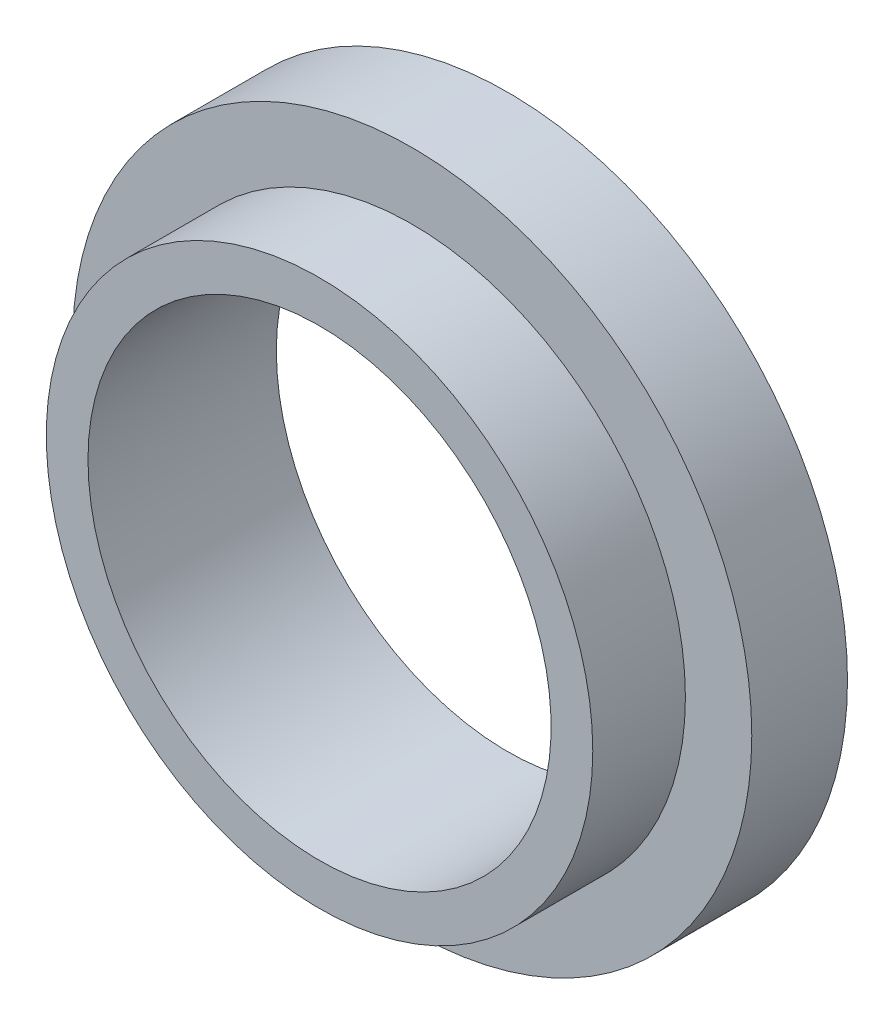
from build123d import *

# Parameters (mm, degrees)
SKETCH1_R               = 55
BOSS_EXTRUDE1_DEPTH     = 15.5
SKETCH2_R               = 44.25
BOSS_EXTRUDE2_DEPTH     = 15
CUT_EXTRUDE3_DEPTH      = 84.547890458
CUT_EXTRUDE3_DEPTH_BACK = 84.547890458
SKETCH3_R               = 37.5


with BuildPart() as part:
    # Sketch1 → Boss-Extrude1 (new body)
    with BuildSketch(Plane.XY):
        Circle(SKETCH1_R)
    extrude(amount=BOSS_EXTRUDE1_DEPTH)

    # Sketch2 → Boss-Extrude2 (add)
    with BuildSketch(Plane.XY.offset(15.5)):
        Circle(SKETCH2_R)
    extrude(amount=BOSS_EXTRUDE2_DEPTH)

    # Sketch3 → Cut-Extrude3 (cut, two sides: drawn at the far end of the back side and taken through both)
    with BuildSketch(Plane(origin=(0, 0, 0), x_dir=(-1, 0, 0), z_dir=(0, 0, -1)).offset(-CUT_EXTRUDE3_DEPTH_BACK)):
        Circle(SKETCH3_R)
    extrude(amount=CUT_EXTRUDE3_DEPTH + CUT_EXTRUDE3_DEPTH_BACK, mode=Mode.SUBTRACT)


solid = part.part
